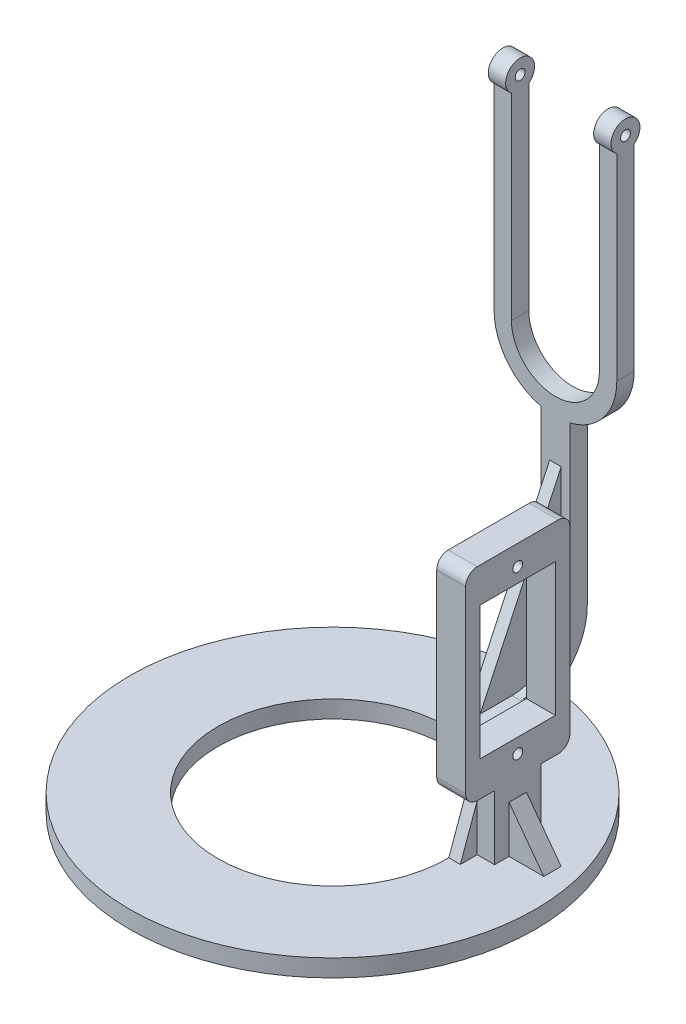
from build123d import *

# Parameters (mm, degrees)
ESBO_O1_R                  = 2.5
RESSALTO_EXTRUS_O1_DEPTH   = 10.6
ESBO_O8_W                  = 21.2
ESBO_O8_H                  = 35
RESSALTO_EXTRUS_O6_DEPTH   = 1.5
RESSALTO_EXTRUS_O2_DEPTH   = 1.5
CORTE_EXTRUS_O1_DEPTH      = 48.855720661
CORTE_EXTRUS_O1_DEPTH_BACK = 48.855720661
ESBO_O3_W                  = 15.2
ESBO_O3_H                  = 37.5
CORTE_EXTRUS_O2_DEPTH      = 48.855720661
CORTE_EXTRUS_O2_DEPTH_BACK = 48.855720661
ESBO_O4_R                  = 0.85
ESBO_O5_W                  = 3
ESBO_O5_H                  = 30
RESSALTO_EXTRUS_O3_DEPTH   = 2.5
RESSALTO_EXTRUS_O4_DEPTH   = 2.5
RESSALTO_EXTRUS_O5_START   = -83.6
ESBO_O7_R                  = 35
RESSALTO_EXTRUS_O5_DEPTH   = 3
NERVURA2_REACH             = 121.79
ESBO_O10_WALL_W            = 274.68518898
ESBO_O10_WALL_H            = 2
ESBO_O11_W                 = 18
ESBO_O11_H                 = 35
RESSALTO_EXTRUS_O7_DEPTH   = 5
ESBO_O12_W                 = 13
ESBO_O12_H                 = 23
CORTE_EXTRUS_O3_DEPTH      = 130.230801453
ESBO_O13_R                 = 0.85
CORTE_EXTRUS_O4_DEPTH      = 130.230801453
ESBO_O14_W                 = 8
ESBO_O14_H                 = 14.1
RESSALTO_EXTRUS_O8_DEPTH   = 5
FILETE1_R                  = 2
NERVURA3_REACH             = 128.994
ESBO_O15_WALL_W            = 11.798728746
ESBO_O15_WALL_H            = 2
ESBO_O16_R                 = 19.8
CORTE_EXTRUS_O5_DEPTH      = 120.428681739
NERVURA4_REACH             = 104.492
ESBO_O17_WALL_W            = 217.06365237
ESBO_O17_WALL_H            = 3


with BuildPart() as part:
    # Esboço1 → Ressalto-extrusão1 (new, symmetric)
    with BuildSketch(Plane(origin=(0, 0, 0), x_dir=(0, 0, -1), z_dir=(1, 0, 0))):
        Circle(ESBO_O1_R)
    extrude(amount=RESSALTO_EXTRUS_O1_DEPTH, both=True)

    # Esboço8 → Ressalto-extrusão6 (add, symmetric)
    with BuildSketch(Plane.XY):
        with Locations((0, -17.5)):
            Rectangle(ESBO_O8_W, ESBO_O8_H)
    extrude(amount=RESSALTO_EXTRUS_O6_DEPTH, both=True)

    # Esboço2 → Ressalto-extrusão2 (add, symmetric)
    with BuildSketch(Plane.XY):
        with BuildLine():
            Line((-10.6, -36), (-10.6, -35))
            Line((-10.6, -35), (-7.6, -35))
            Line((-7.6, -35), (-7.6, -36))
            ThreePointArc((-7.6, -36), (0, -43.6), (7.6, -36))
            Line((7.6, -36), (7.6, -35))
            Line((7.6, -35), (10.6, -35))
            Line((10.6, -35), (10.6, -36))
            ThreePointArc((10.6, -36), (0, -46.6), (-10.6, -36))
        make_face()
    extrude(amount=RESSALTO_EXTRUS_O2_DEPTH, both=True)

    # Esboço3 → Corte-extrusão1 (cut, two sides: drawn at the far end of the back side and taken through both)
    with BuildSketch(Plane.XY.offset(-CORTE_EXTRUS_O1_DEPTH_BACK)):
        with Locations((0, -16.25)):
            Rectangle(ESBO_O3_W, ESBO_O3_H)
    extrude(amount=CORTE_EXTRUS_O1_DEPTH + CORTE_EXTRUS_O1_DEPTH_BACK, mode=Mode.SUBTRACT)

    # Esboço4 → Corte-extrusão2 (cut, two sides: drawn at the far end of the back side and taken through both)
    with BuildSketch(Plane(origin=(0, 0, 0), x_dir=(0, 0, -1), z_dir=(1, 0, 0)).offset(-CORTE_EXTRUS_O2_DEPTH_BACK)):
        Circle(ESBO_O4_R)
    extrude(amount=CORTE_EXTRUS_O2_DEPTH + CORTE_EXTRUS_O2_DEPTH_BACK, mode=Mode.SUBTRACT)

    # Esboço5 → Ressalto-extrusão3 (add, symmetric)
    with BuildSketch(Plane(origin=(0, 0, 0), x_dir=(0, 0, -1), z_dir=(1, 0, 0))):
        with Locations((0, -60.1)):
            Rectangle(ESBO_O5_W, ESBO_O5_H)
    extrude(amount=RESSALTO_EXTRUS_O3_DEPTH, both=True)

    # Esboço6 → Ressalto-extrusão4 (add, symmetric)
    with BuildSketch(Plane(origin=(0, 0, 0), x_dir=(0, 0, -1), z_dir=(1, 0, 0))):
        with BuildLine():
            ThreePointArc((-10, -86.6), (-1.868272016, -83.231727984), (1.5, -75.1))
            ThreePointArc((1.5, -75.1), (0, -73.6), (-1.5, -75.1))
            ThreePointArc((-1.5, -75.1), (-3.98959236, -81.11040764), (-10, -83.6))
            ThreePointArc((-10, -83.6), (-11.5, -85.1), (-10, -86.6))
        make_face()
    extrude(amount=RESSALTO_EXTRUS_O4_DEPTH, both=True)

    # Esboço7 → Ressalto-extrusão5 (add)
    with BuildSketch(Plane(origin=(0, 0, 0), x_dir=(1, 0, 0), z_dir=(0, 1, 0)).offset(RESSALTO_EXTRUS_O5_START)):
        with Locations(Location((0, -40, 0), (0, 0, 270))):
            Circle(ESBO_O7_R)
    extrude(amount=-RESSALTO_EXTRUS_O5_DEPTH)

    # Esboço10 wall → Nervura2 (add, up to next)
    with BuildSketch(Plane(origin=(0, -68.6, 8.5), x_dir=(0, -0.906183139995, 0.422885465331), z_dir=(0, -0.422885465331, -0.906183139995)), mode=Mode.PRIVATE) as nervura2_sk1:
        Rectangle(ESBO_O10_WALL_W, ESBO_O10_WALL_H)
    nervura2_tool1 = extrude(nervura2_sk1.sketch, amount=NERVURA2_REACH, mode=Mode.PRIVATE) - part.part
    add(nervura2_tool1.solids().sort_by_distance((0, -68.6, 8.5))[0])



with BuildPart() as body_2:
    # Esboço11 → Ressalto-extrusão7 (new body)
    with BuildSketch(Plane(origin=(19.8, 0, 0), x_dir=(0, 0, -1), z_dir=(1, 0, 0))):
        with Locations((-32.81, -55)):
            Rectangle(ESBO_O11_W, ESBO_O11_H)
    extrude(amount=RESSALTO_EXTRUS_O7_DEPTH)

    # Esboço12 → Corte-extrusão3 (cut, through all)
    with BuildSketch(Plane(origin=(24.8, 0, 0), x_dir=(0, 0, -1), z_dir=(1, 0, 0))):
        with Locations((-32.81, -55)):
            Rectangle(ESBO_O12_W, ESBO_O12_H)
    extrude(amount=-CORTE_EXTRUS_O3_DEPTH, mode=Mode.SUBTRACT)

    # Esboço13 → Corte-extrusão4 (cut, through all)
    with BuildSketch(Plane(origin=(24.8, 0, 0), x_dir=(0, 0, -1), z_dir=(1, 0, 0))):
        with Locations((-32.81, -41)):
            Circle(ESBO_O13_R)
        with Locations((-32.81, -69)):
            Circle(ESBO_O13_R)
    extrude(amount=-CORTE_EXTRUS_O4_DEPTH, mode=Mode.SUBTRACT)


with BuildPart() as part_1:
    add(part.part)

    add(body_2.part)  # Ressalto-extrusão8 merges body 2
    # Esboço14 → Ressalto-extrusão8 (add)
    with BuildSketch(Plane.ZY.offset(-19.8)):
        with Locations((32.81, -79.55)):
            Rectangle(ESBO_O14_W, ESBO_O14_H)
    extrude(amount=-RESSALTO_EXTRUS_O8_DEPTH)

    # Filete1
    filete1_edges = [part_1.edges().sort_by_distance(p)[0] for p in [
        (22.3, -37.5, 41.81),
        (22.3, -72.5, 41.81),
        (22.3, -72.5, 23.81),
        (22.3, -37.5, 23.81),
    ]]
    fillet(filete1_edges, radius=FILETE1_R)

    # Esboço15 wall → Nervura3 (add, up to next)
    with BuildSketch(Plane(origin=(19.8, -81.05, 26.81), x_dir=(0, -0.94077931952, -0.339019574602), z_dir=(0, 0.339019574602, -0.94077931952)), mode=Mode.PRIVATE) as nervura3_sk1:
        with Locations((0, -1)):
            Rectangle(ESBO_O15_WALL_W, ESBO_O15_WALL_H)
    nervura3_tool1 = extrude(nervura3_sk1.sketch, amount=-NERVURA3_REACH, mode=Mode.PRIVATE) - part_1.part
    nervura3 = nervura3_tool1.solids().sort_by_distance((19.8, -81.05, 26.81))[0]
    add(nervura3)

    # Espelhar2: Nervura3 across plane
    add(nervura3.mirror(Plane.XY.offset(32.81)))

    # Esboço16 → Corte-extrusão5 (cut, through all)
    with BuildSketch(Plane(origin=(0, -83.6, 0), x_dir=(1, 0, 0), z_dir=(0, 1, 0))):
        with Locations(Location((0, -40, 0), (0, 0, 270))):
            Circle(ESBO_O16_R)
    extrude(amount=-CORTE_EXTRUS_O5_DEPTH, mode=Mode.SUBTRACT)

    # Esboço17 wall → Nervura4 (add, up to next)
    with BuildSketch(Plane(origin=(27.8, -79.55, 32.81), x_dir=(0.595227550626, -0.803557193345, 0), z_dir=(0.803557193345, 0.595227550626, 0)), mode=Mode.PRIVATE) as nervura4_sk1:
        Rectangle(ESBO_O17_WALL_W, ESBO_O17_WALL_H)
    nervura4_tool1 = extrude(nervura4_sk1.sketch, amount=-NERVURA4_REACH, mode=Mode.PRIVATE) - part_1.part
    add(nervura4_tool1.solids().sort_by_distance((27.8, -79.55, 32.81))[0])


solid = part_1.part
